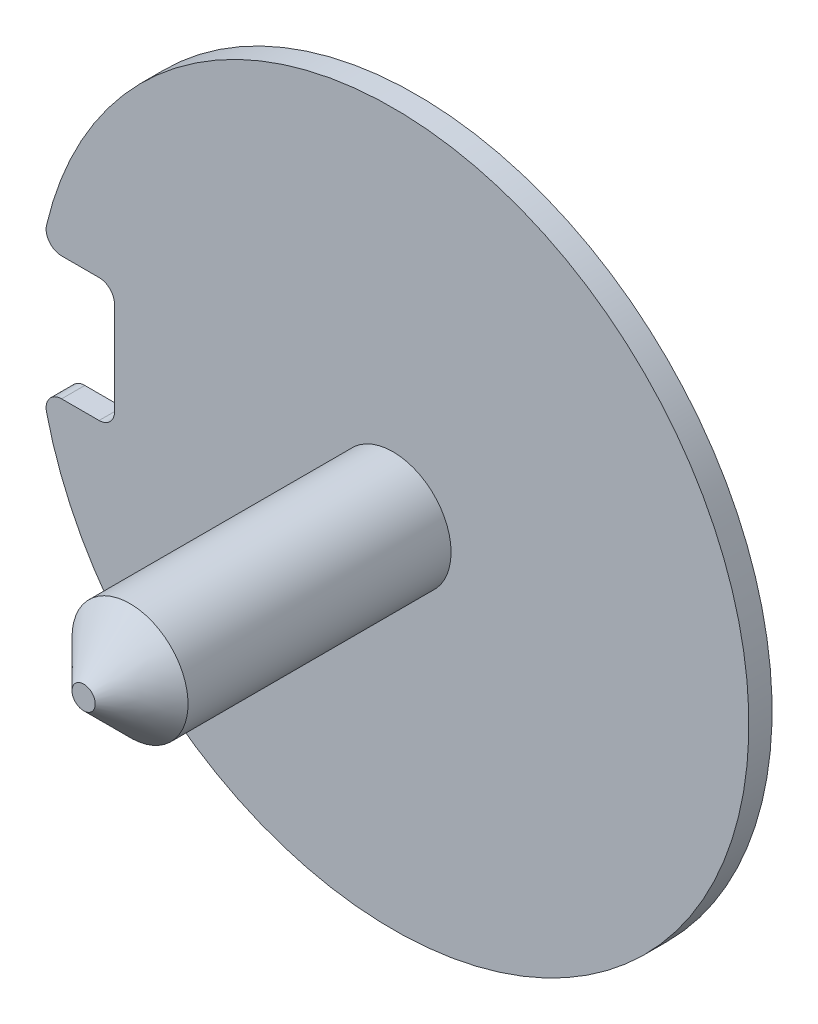
from build123d import *

# Parameters (mm, degrees)
SKETCH1_R           = 46
BOSS_EXTRUDE1_DEPTH = 3
SKETCH3_R           = 3.05
CUT_EXTRUDE2_DEPTH  = 1.1
CUT_EXTRUDE1_DEPTH  = 2.2
SKETCH4_R           = 7.5
BOSS_EXTRUDE2_DEPTH = 40
CHAMFER1_SIZE       = 6
SIZE_MEDICINE_REACH = 84.952
SKETCH5_W           = 10
SKETCH5_H           = 16
FILLET1_R           = 2


with BuildPart() as part:
    # Sketch1 → Boss-Extrude1 (new body)
    with BuildSketch(Plane.XY):
        with Locations((0, 8)):
            Circle(SKETCH1_R)
    extrude(amount=BOSS_EXTRUDE1_DEPTH)

    # Sketch3 → Cut-Extrude2 (cut)
    with BuildSketch(Plane(origin=(0, 0, 0), x_dir=(-1, 0, 0), z_dir=(0, 0, -1))):
        Circle(SKETCH3_R)
        with Locations(Location((0, 16, 0), (0, 0, 180))):
            Circle(SKETCH3_R)
    extrude(amount=-CUT_EXTRUDE2_DEPTH, mode=Mode.SUBTRACT)

    # Sketch2 → Cut-Extrude1 (cut)
    with BuildSketch(Plane(origin=(0, 0, 0), x_dir=(-1, 0, 0), z_dir=(0, 0, -1))):
        with BuildLine():
            Line((-7.95, 9.05), (-7.95, 6.95))
            ThreePointArc((-7.95, 6.95), (-9, 5.9), (-10.05, 6.95))
            Line((-10.05, 6.95), (-10.05, 9.05))
            ThreePointArc((-10.05, 9.05), (-9, 10.1), (-7.95, 9.05))
        make_face()
        with BuildLine():
            Line((7.95, 9.05), (7.95, 6.95))
            ThreePointArc((7.95, 6.95), (9, 5.9), (10.05, 6.95))
            Line((10.05, 6.95), (10.05, 9.05))
            ThreePointArc((10.05, 9.05), (9, 10.1), (7.95, 9.05))
        make_face()
    extrude(amount=-CUT_EXTRUDE1_DEPTH, mode=Mode.SUBTRACT)

    # Sketch4 → Boss-Extrude2 (add)
    with BuildSketch(Plane.XY.offset(3)):
        with Locations((0, 8)):
            Circle(SKETCH4_R)
    extrude(amount=BOSS_EXTRUDE2_DEPTH)

    # Chamfer1
    chamfer1_edges = [part.edges().sort_by_distance(p)[0] for p in [
        (-7.5, 8, 43),
    ]]
    chamfer(chamfer1_edges, length=CHAMFER1_SIZE)

    # Sketch5 → Size-Medicine (cut, up to next)
    with BuildSketch(Plane(origin=(0, 0, 0), x_dir=(-1, 0, 0), z_dir=(0, 0, -1)), mode=Mode.PRIVATE) as size_medicine_sk1:
        with Locations((41, 8)):
            Rectangle(SKETCH5_W, SKETCH5_H)
    size_medicine_tool1 = extrude(size_medicine_sk1.sketch, amount=-SIZE_MEDICINE_REACH, mode=Mode.PRIVATE) & part.part
    add(size_medicine_tool1.solids().sort_by_distance((-41, 8, 0))[0], mode=Mode.SUBTRACT)

    # Fillet1
    fillet1_edges = [part.edges().sort_by_distance(p)[0] for p in [
        (-45.299006612, 0, 1.5),
        (-45.299006612, 16, 1.5),
        (-36, 16, 1.5),
        (-36, 0, 1.5),
    ]]
    fillet(fillet1_edges, radius=FILLET1_R)


solid = part.part
